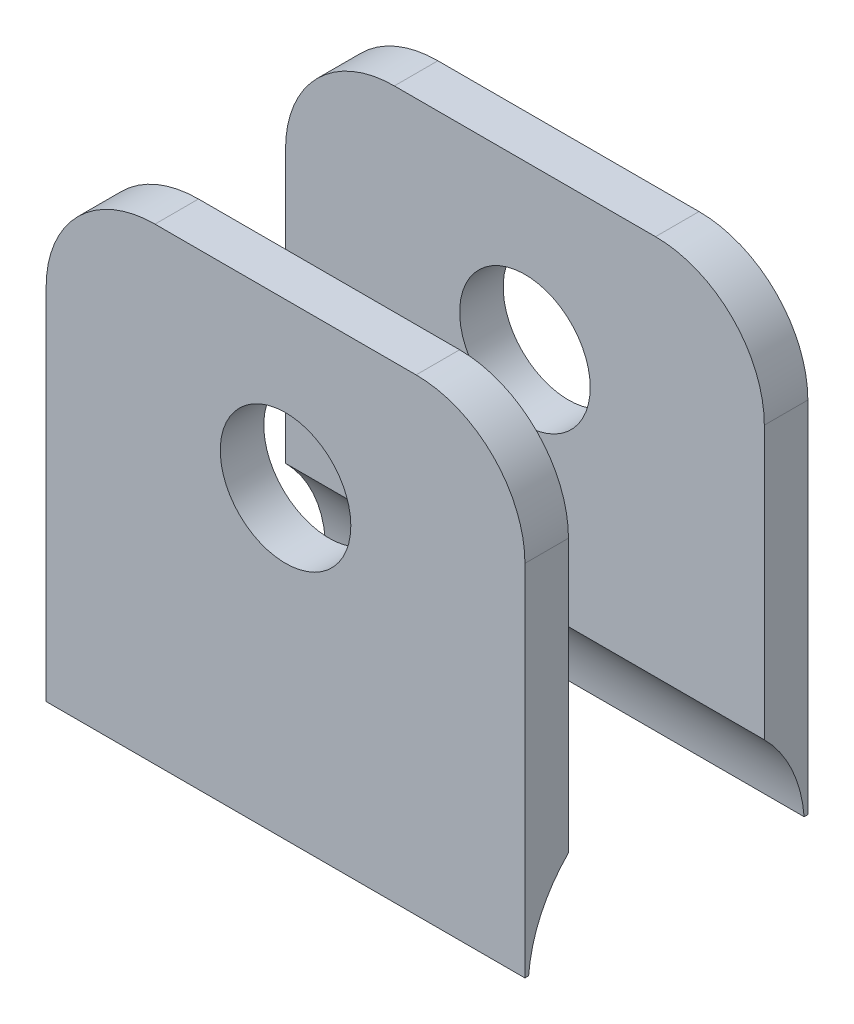
from build123d import *

# Parameters (mm, degrees)
SKETCH2_R               = 6
BOSS_EXTRUDE1_DEPTH     = 4
FILLET1_R               = 10
CUT_EXTRUDE1_DEPTH      = 25
CUT_EXTRUDE1_DEPTH_BACK = 25
SKETCH3_R               = 12.7


with BuildPart() as part:
    # Sketch2 → Boss-Extrude1 (new body)
    with BuildSketch(Plane.XY.offset(9)):
        Polygon((-22, 0), (-22, 15), (22, 15), (22, -28), (-22, -28), align=None)
        Circle(SKETCH2_R, mode=Mode.SUBTRACT)
    extrude(amount=BOSS_EXTRUDE1_DEPTH)

    # Fillet1
    fillet1_edges = [part.edges().sort_by_distance(p)[0] for p in [
        (-22, 15, 11),
        (22, 15, 11),
    ]]
    fillet(fillet1_edges, radius=FILLET1_R)


with BuildPart() as body_2:
    # Mirror2: mirrored copy
    add(part.part.mirror(Plane.XY))


with BuildPart() as cut_extrude1_tool:
    # Sketch3 → Cut-Extrude1 (new, two sides: drawn at the far end of the back side and taken through both)
    with BuildSketch(Plane(origin=(0, 0, 0), x_dir=(0, 0, -1), z_dir=(1, 0, 0)).offset(-CUT_EXTRUDE1_DEPTH_BACK)):
        with Locations((0, -29)):
            Circle(SKETCH3_R)
    extrude(amount=CUT_EXTRUDE1_DEPTH + CUT_EXTRUDE1_DEPTH_BACK)


with BuildPart() as part_1:
    add(part.part)

    # Cut-Extrude1: cut by cut_extrude1_tool
    add(cut_extrude1_tool.part, mode=Mode.SUBTRACT)


with BuildPart() as body_2_1:
    add(body_2.part)

    # Cut-Extrude1: cut by cut_extrude1_tool
    add(cut_extrude1_tool.part, mode=Mode.SUBTRACT)


solid = Compound([part_1.part, body_2_1.part])
